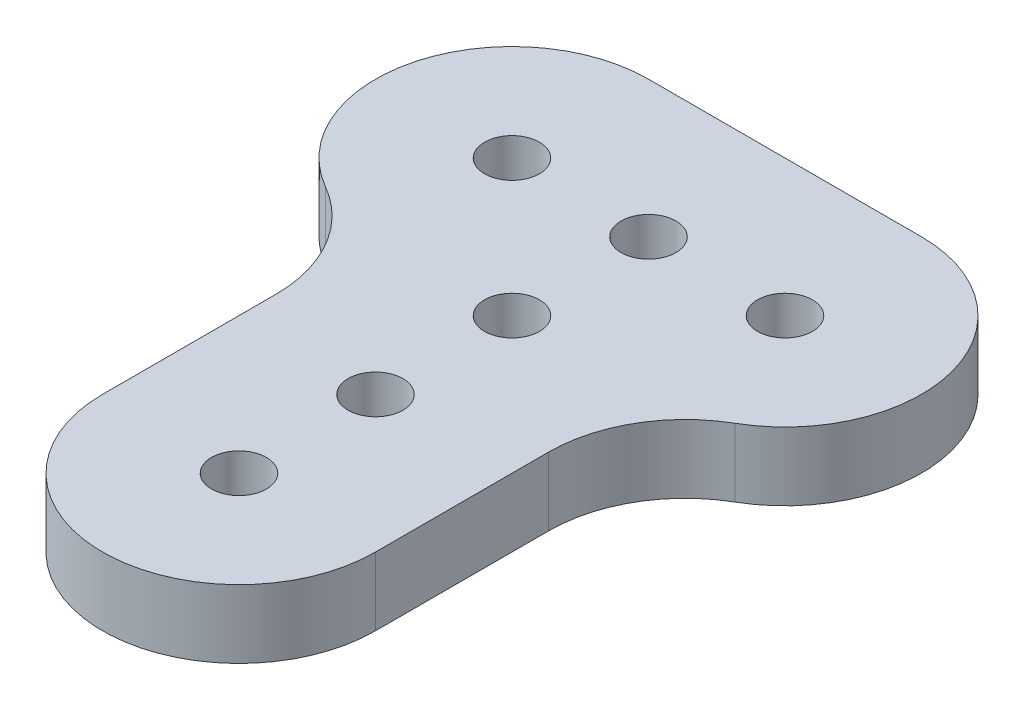
from build123d import *

# Parameters (mm, degrees)
SKETCH1_R           = 2.5527
BOSS_EXTRUDE1_DEPTH = 3.175
FILLET1_R           = 12.7


with BuildPart() as part:
    # Sketch1 → Boss-Extrude1 (new, symmetric)
    with BuildSketch(Plane(origin=(0, 0, 0), x_dir=(1, 0, 0), z_dir=(0, 1, 0))):
        with BuildLine():
            ThreePointArc((12.7, 12.7), (0, 0), (12.7, -12.7))
            Line((12.7, -12.7), (12.7, -38.1))
            ThreePointArc((12.7, -38.1), (25.4, -50.8), (38.1, -38.1))
            Line((38.1, -38.1), (38.1, -12.7))
            ThreePointArc((38.1, -12.7), (50.8, 0), (38.1, 12.7))
            Line((38.1, 12.7), (12.7, 12.7))
        make_face()
        with Locations(Location((25.4, -12.7, 0), (0, 0, 270))):
            Circle(SKETCH1_R, mode=Mode.SUBTRACT)
        with Locations(Location((12.7, 0, 0), (0, 0, 270))):
            Circle(SKETCH1_R, mode=Mode.SUBTRACT)
        with Locations(Location((38.1, 0, 0), (0, 0, 270))):
            Circle(SKETCH1_R, mode=Mode.SUBTRACT)
        with Locations(Location((25.4, 0, 0), (0, 0, 270))):
            Circle(SKETCH1_R, mode=Mode.SUBTRACT)
        with Locations(Location((25.4, -25.4, 0), (0, 0, 270))):
            Circle(SKETCH1_R, mode=Mode.SUBTRACT)
        with Locations(Location((25.4, -38.1, 0), (0, 0, 270))):
            Circle(SKETCH1_R, mode=Mode.SUBTRACT)
    extrude(amount=BOSS_EXTRUDE1_DEPTH, both=True)

    # Fillet1
    fillet1_edges = [part.edges().sort_by_distance(p)[0] for p in [
        (38.1, 0, 12.7),
        (12.7, 0, 12.7),
    ]]
    fillet(fillet1_edges, radius=FILLET1_R)


solid = part.part
